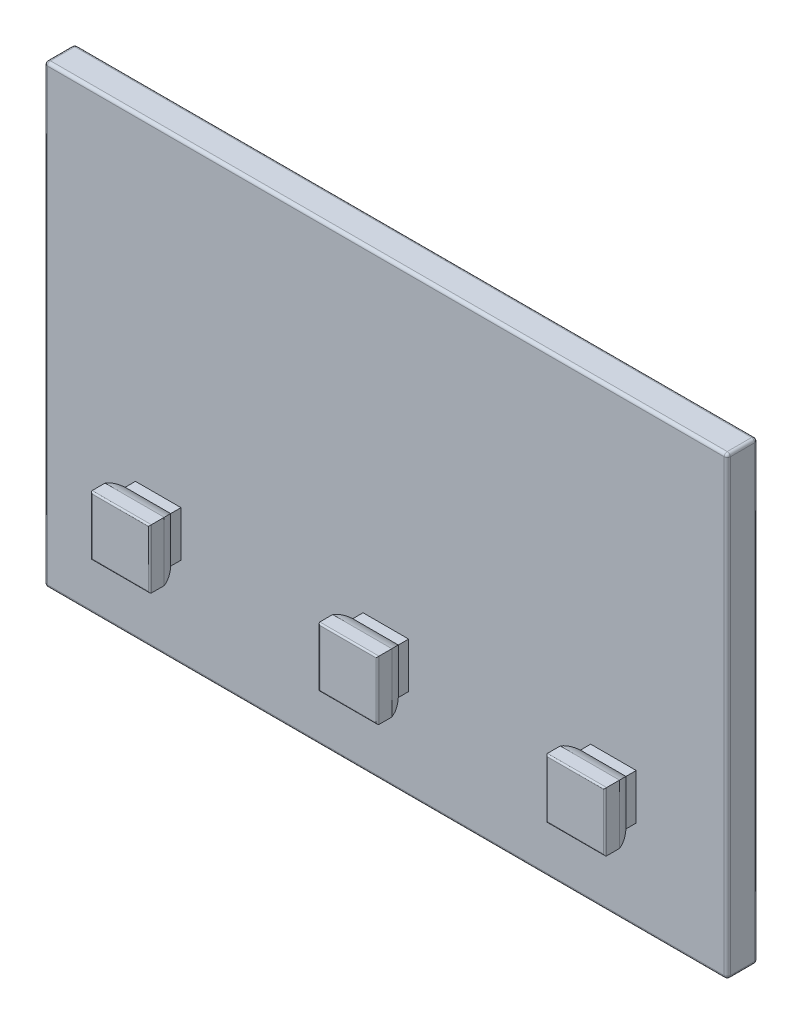
from build123d import *

# Parameters (mm, degrees)
SKETCH_1_W          = 45
SKETCH_1_H          = 30
EXTRUDE_1_DEPTH     = 2
SKETCH_2_W          = 3
SKETCH_2_H          = 3
EXTRUDE_2_DEPTH     = 1
EXTRUDE_START       = -4
EXTRUDE_3_DEPTH     = 5
CUT_EXTRUDE_1_REACH = 35.321
FILLET_1_R          = 0.1
FILLET_2_R          = 0.2


with BuildPart() as part:
    # 草图1 → 凸台-拉伸1 (new body)
    with BuildSketch(Plane.XY):
        with Locations((0, 7.5)):
            Rectangle(SKETCH_1_W, SKETCH_1_H)
    extrude(amount=-EXTRUDE_1_DEPTH)

    # 草图2 → 凸台-拉伸2 (add)
    with BuildSketch(Plane.XY):
        Rectangle(SKETCH_2_W, SKETCH_2_H)
    extrude_2 = extrude(amount=EXTRUDE_2_DEPTH)

    # 草图3 → 凸台-拉伸3 (add)
    with BuildSketch(Plane.XZ.offset(1.5).offset(EXTRUDE_START)):
        with BuildLine():
            Line((-1.95, 2.5), (1.95, 2.5))
            Line((1.95, 2.5), (1.95, 1.555590279))
            ThreePointArc((1.95, 1.555590279), (1.780042303, 1.088161527), (1.5, 0.677124344))
            Line((1.5, 0.677124344), (-1.5, 0.677124344))
            ThreePointArc((-1.5, 0.677124344), (-1.780042303, 1.088161527), (-1.95, 1.555590279))
            Line((-1.95, 1.555590279), (-1.95, 2.5))
        make_face()
    extrude_3 = extrude(amount=EXTRUDE_3_DEPTH)

    # 草图4 → 切除-拉伸1 (cut, up to next)
    with BuildSketch(Plane.ZY.offset(1.95), mode=Mode.PRIVATE) as cut_extrude_1_sk1:
        with BuildLine():
            Line((0.677124344, 1.5), (0.677124344, 2.5))
            Line((0.677124344, 2.5), (2.5, 2.5))
            Line((2.5, 2.5), (2.5, 1.95))
            Line((2.5, 1.95), (1.555590279, 1.95))
            ThreePointArc((1.555590279, 1.95), (1.088161527, 1.780042303), (0.677124344, 1.5))
        make_face()
    cut_extrude_1_tool1 = extrude(cut_extrude_1_sk1.sketch, amount=-CUT_EXTRUDE_1_REACH, mode=Mode.PRIVATE) & part.part
    # 草图4 → 切除-拉伸1 (cut, up to next)
    with BuildSketch(Plane.ZY.offset(1.95), mode=Mode.PRIVATE) as cut_extrude_1_sk2:
        with BuildLine():
            Line((0.677124344, -2.5), (2.5, -2.5))
            Line((2.5, -2.5), (2.5, -1.95))
            Line((2.5, -1.95), (1.555590279, -1.95))
            ThreePointArc((1.555590279, -1.95), (1.088161527, -1.780042303), (0.677124344, -1.5))
            Line((0.677124344, -1.5), (0.677124344, -2.5))
        make_face()
    cut_extrude_1_tool2 = extrude(cut_extrude_1_sk2.sketch, amount=-CUT_EXTRUDE_1_REACH, mode=Mode.PRIVATE) & part.part
    cut_extrude_1_1 = cut_extrude_1_tool1.solids().sort_by_distance((-1.95, 2.169375, 1.500125))[0]
    add(cut_extrude_1_1, mode=Mode.SUBTRACT)
    cut_extrude_1_2 = cut_extrude_1_tool2.solids().sort_by_distance((-1.95, -2.169375, 1.500125))[0]
    add(cut_extrude_1_2, mode=Mode.SUBTRACT)
    cut_extrude_1 = cut_extrude_1_1 + cut_extrude_1_2  # 切除-拉伸1 as one shape, for the pattern or mirror that repeats it

    # 镜向1: 凸台-拉伸2, 凸台-拉伸3, 切除-拉伸1 across plane
    add(extrude_2.mirror(Plane(origin=(7.5, 0, 0), x_dir=(0, 0, 1), z_dir=(1, 0, 0))))
    add(extrude_3.mirror(Plane(origin=(7.5, 0, 0), x_dir=(0, 0, 1), z_dir=(1, 0, 0))))
    add(cut_extrude_1.mirror(Plane(origin=(7.5, 0, 0), x_dir=(0, 0, 1), z_dir=(1, 0, 0))), mode=Mode.SUBTRACT)

    # 镜向2: 凸台-拉伸2, 凸台-拉伸3, 切除-拉伸1 across plane
    add(extrude_2.mirror(Plane(origin=(-7.5, 0, 0), x_dir=(0, 0, 1), z_dir=(1, 0, 0))))
    add(extrude_3.mirror(Plane(origin=(-7.5, 0, 0), x_dir=(0, 0, 1), z_dir=(1, 0, 0))))
    add(cut_extrude_1.mirror(Plane(origin=(-7.5, 0, 0), x_dir=(0, 0, 1), z_dir=(1, 0, 0))), mode=Mode.SUBTRACT)

    # 圆角1
    fillet_1_edges = [part.edges().sort_by_distance(p)[0] for p in [
        (15, -1.95, 2.5),
        (16.95, 0, 2.5),
        (13.05, 0, 2.5),
        (15, 1.95, 2.5),
        (-15, -1.95, 2.5),
        (-13.05, 0, 2.5),
        (-16.95, 0, 2.5),
        (-15, 1.95, 2.5),
        (0, -1.95, 2.5),
        (1.95, 0, 2.5),
        (-1.95, 0, 2.5),
        (0, 1.95, 2.5),
    ]]
    fillet(fillet_1_edges, radius=FILLET_1_R)

    # 圆角2
    fillet_2_edges = [part.edges().sort_by_distance(p)[0] for p in [
        (22.5, 7.5, -2),
        (0, 22.5, -2),
        (-22.5, 7.5, -2),
        (0, 22.5, 0),
        (22.5, 7.5, 0),
        (0, -7.5, 0),
        (-22.5, 7.5, 0),
        (0, -7.5, -2),
        (-22.5, 22.5, -1),
        (22.5, 22.5, -1),
        (22.5, -7.5, -1),
        (-22.5, -7.5, -1),
    ]]
    fillet(fillet_2_edges, radius=FILLET_2_R)


solid = part.part
